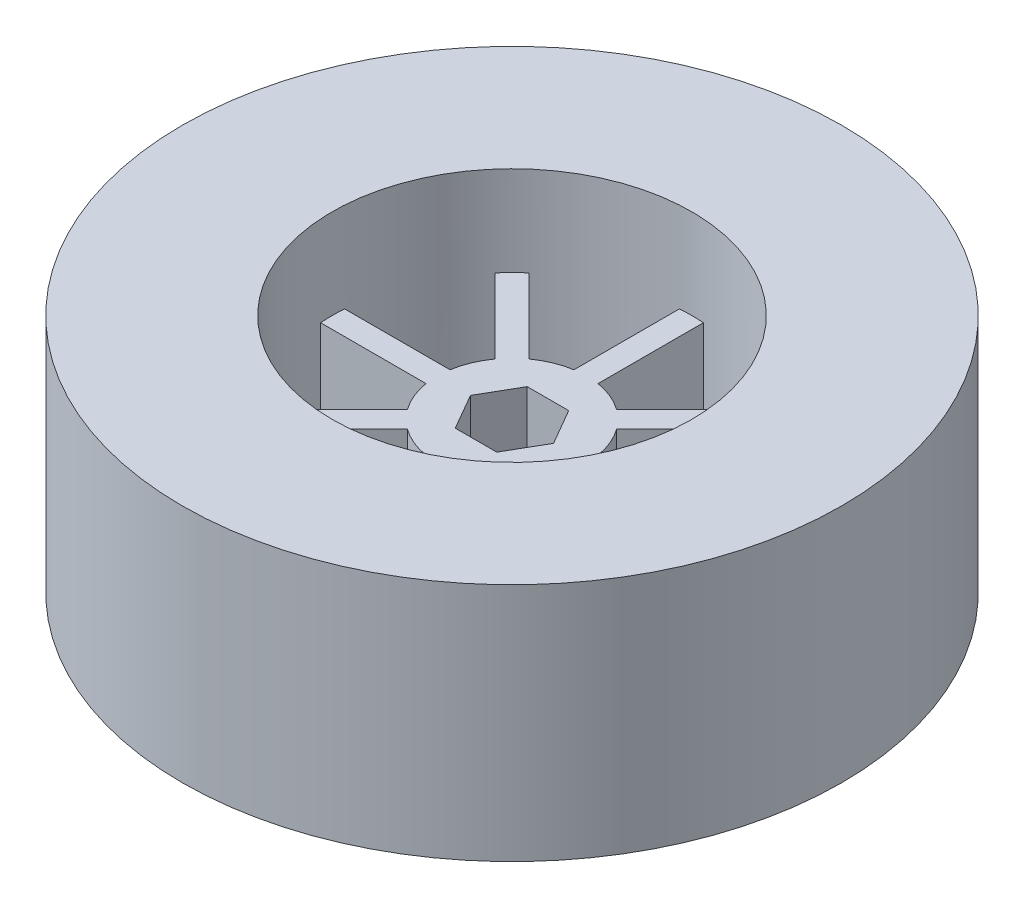
from build123d import *

# Parameters (mm, degrees)
SKETCH2_R           = 55
WHEEL_EXTRUDE_DEPTH = 40
WHEEL_INSET_START   = -15
SKETCH4_R           = 30
WHEEL_INSET_DEPTH   = 15
HUB_INSET_DEPTH     = 25


with BuildPart() as part:
    # Sketch2 → Wheel_Extrude (new body)
    with BuildSketch(Plane(origin=(0, 0, 0), x_dir=(1, 0, 0), z_dir=(0, 1, 0))):
        Circle(SKETCH2_R)
        with BuildLine():
            Line((2, 29.933259094), (2, 12.338962679))
            ThreePointArc((2, 12.338962679), (4.783542905, 11.548494156), (7.310750621, 10.139177746))
            Line((7.310750621, 10.139177746), (19.751796926, 22.580224051))
            ThreePointArc((19.751796926, 22.580224051), (11.480502971, 27.716385975), (2, 29.933259094))
        make_face(mode=Mode.SUBTRACT)
        with BuildLine():
            Line((-2, 29.933259094), (-2, 12.338962679))
            ThreePointArc((-2, 12.338962679), (-4.783542905, 11.548494156), (-7.310750621, 10.139177746))
            Line((-7.310750621, 10.139177746), (-19.751796926, 22.580224051))
            ThreePointArc((-19.751796926, 22.580224051), (-11.480502971, 27.716385975), (-2, 29.933259094))
        make_face(mode=Mode.SUBTRACT)
        with BuildLine():
            Line((22.580224051, 19.751796926), (10.139177746, 7.310750621))
            ThreePointArc((10.139177746, 7.310750621), (11.548494156, 4.783542905), (12.338962679, 2))
            Line((12.338962679, 2), (29.933259094, 2))
            ThreePointArc((29.933259094, 2), (27.716385975, 11.480502971), (22.580224051, 19.751796926))
        make_face(mode=Mode.SUBTRACT)
        with BuildLine():
            Line((29.933259094, -2), (12.338962679, -2))
            ThreePointArc((12.338962679, -2), (11.548494156, -4.783542905), (10.139177746, -7.310750621))
            Line((10.139177746, -7.310750621), (22.580224051, -19.751796926))
            ThreePointArc((22.580224051, -19.751796926), (27.716385975, -11.480502971), (29.933259094, -2))
        make_face(mode=Mode.SUBTRACT)
        with BuildLine():
            Line((19.751796926, -22.580224051), (7.310750621, -10.139177746))
            ThreePointArc((7.310750621, -10.139177746), (4.783542905, -11.548494156), (2, -12.338962679))
            Line((2, -12.338962679), (2, -29.933259094))
            ThreePointArc((2, -29.933259094), (11.480502971, -27.716385975), (19.751796926, -22.580224051))
        make_face(mode=Mode.SUBTRACT)
        with BuildLine():
            Line((-2, -29.933259094), (-2, -12.338962679))
            ThreePointArc((-2, -12.338962679), (-4.783542905, -11.548494156), (-7.310750621, -10.139177746))
            Line((-7.310750621, -10.139177746), (-19.751796926, -22.580224051))
            ThreePointArc((-19.751796926, -22.580224051), (-11.480502971, -27.716385975), (-2, -29.933259094))
        make_face(mode=Mode.SUBTRACT)
        with BuildLine():
            Line((-22.580224051, -19.751796926), (-10.139177746, -7.310750621))
            ThreePointArc((-10.139177746, -7.310750621), (-11.548494156, -4.783542905), (-12.338962679, -2))
            Line((-12.338962679, -2), (-29.933259094, -2))
            ThreePointArc((-29.933259094, -2), (-27.716385975, -11.480502971), (-22.580224051, -19.751796926))
        make_face(mode=Mode.SUBTRACT)
        with BuildLine():
            Line((-29.933259094, 2), (-12.338962679, 2))
            ThreePointArc((-12.338962679, 2), (-11.548494156, 4.783542905), (-10.139177746, 7.310750621))
            Line((-10.139177746, 7.310750621), (-22.580224051, 19.751796926))
            ThreePointArc((-22.580224051, 19.751796926), (-27.716385975, 11.480502971), (-29.933259094, 2))
        make_face(mode=Mode.SUBTRACT)
    extrude(amount=WHEEL_EXTRUDE_DEPTH)

    # Sketch4 → Wheel_Inset (cut)
    with BuildSketch(Plane(origin=(0, 40, 0), x_dir=(1, 0, 0), z_dir=(0, 1, 0)).offset(WHEEL_INSET_START)):
        Circle(SKETCH4_R)
    extrude(amount=WHEEL_INSET_DEPTH, mode=Mode.SUBTRACT)

    # Sketch4<4> → Hub_Inset (cut)
    with BuildSketch(Plane(origin=(0, 40, 0), x_dir=(1, 0, 0), z_dir=(0, 1, 0))):
        Polygon((6.92820323, 0), (3.464101615, 6), (-3.464101615, 6), (-6.92820323, 0), (-3.464101615, -6), (3.464101615, -6), align=None)
    extrude(amount=-HUB_INSET_DEPTH, mode=Mode.SUBTRACT)


solid = part.part
